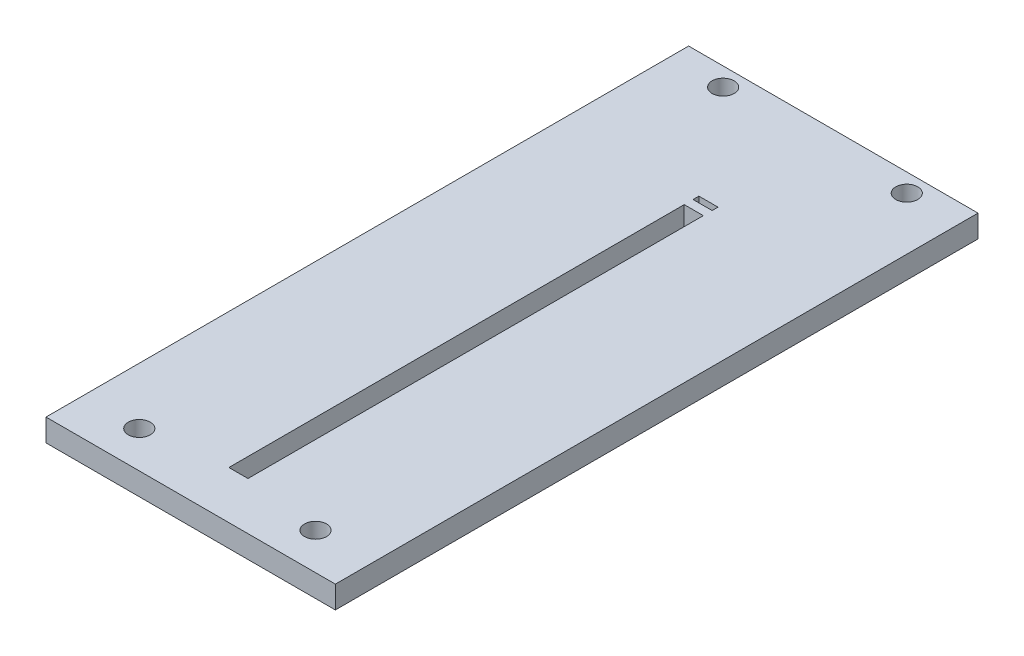
from build123d import *

# Parameters (mm, degrees)
SKETCH1_W             = 39.4
SKETCH1_H             = 87.5
BOSS_EXTRUDE1_DEPTH   = 3.05
SKETCH4_W             = 1.3
SKETCH4_H             = 0.8
SKETCH4_H_2           = 62
CUT_EXTRUDE1_DEPTH    = 90.742088788
SKETCH7_R             = 1.5
CUT_EXTRUDE4_DEPTH    = 90.742088788
F_3_0MM_DOWEL_HOLE1_D = 3


with BuildPart() as part:
    # Sketch1 → Boss-Extrude1 (new body)
    with BuildSketch(Plane(origin=(0, 0, 0), x_dir=(1, 0, 0), z_dir=(0, 1, 0))):
        with Locations((0, 43.75)):
            Rectangle(SKETCH1_W, SKETCH1_H)
    extrude(amount=BOSS_EXTRUDE1_DEPTH)

    # Sketch4 → Cut-Extrude1 (cut, through all)
    with BuildSketch(Plane(origin=(0, 3.05, 0), x_dir=(1, 0, 0), z_dir=(0, 1, 0))):
        with Locations((-0.65, 70.1)):
            Rectangle(SKETCH4_W, SKETCH4_H)
        with Locations((-0.65, 37.5)):
            Rectangle(SKETCH4_W, SKETCH4_H_2)
        with Locations((0.65, 37.5)):
            Rectangle(SKETCH4_W, SKETCH4_H_2)
        with Locations((0.65, 70.1)):
            Rectangle(SKETCH4_W, SKETCH4_H)
    extrude(amount=-CUT_EXTRUDE1_DEPTH, mode=Mode.SUBTRACT)

    # Sketch7 → Cut-Extrude4 (cut, through all)
    with BuildSketch(Plane(origin=(0, 3.05, 0), x_dir=(1, 0, 0), z_dir=(0, 1, 0))):
        with Locations(Location((-12, 5, 0), (0, 0, 270))):
            Circle(SKETCH7_R)
        with Locations(Location((12, 5, 0), (0, 0, 90))):
            Circle(SKETCH7_R)
    extrude(amount=-CUT_EXTRUDE4_DEPTH, mode=Mode.SUBTRACT)

    # Ø3.0mm Dowel Hole1 (through all)
    with Locations(Plane(origin=(0, 3.05, 0), x_dir=(1, 0, 0), z_dir=(0, 1, 0))):
        with Locations((-12.5, 85), (12.5, 85)):
            Hole(F_3_0MM_DOWEL_HOLE1_D / 2)


solid = part.part
